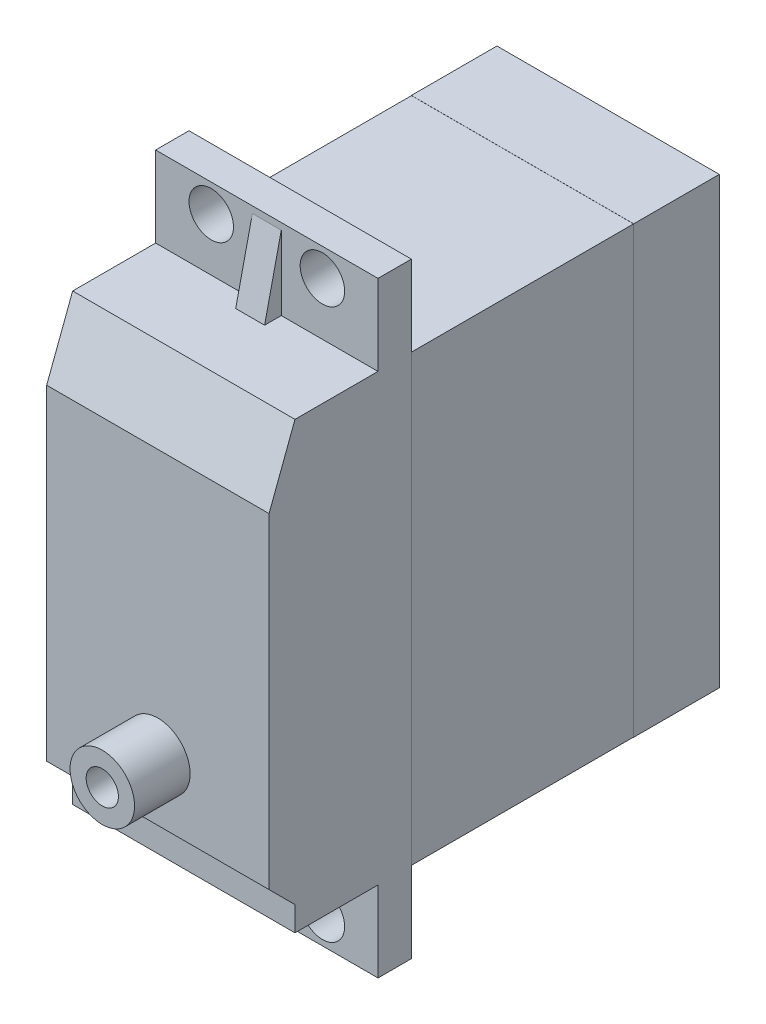
from build123d import *

# Parameters (mm, degrees)
SKETCH1_W                = 40
SKETCH1_H                = 20
BOSS_EXTRUDE1_DEPTH      = 40.5
SKETCH2_W                = 7.25
SKETCH2_H                = 3
BOSS_EXTRUDE2_DEPTH      = 20
SKETCH3_R                = 2
CUT_EXTRUDE1_DEPTH       = 3
SKETCH4_R                = 2.9
SKETCH4_R_2              = 1.45
BOSS_EXTRUDE3_DEPTH      = 5
CUT_EXTRUDE2_DEPTH       = 20
SKETCH5_W                = 20
SKETCH5_H                = 40
SKETCH5_W_2              = 19.98
SKETCH5_H_2              = 39.98
CUT_EXTRUDE3_DEPTH       = 20
BOSS_EXTRUDE5_DEPTH      = 1.3
BOSS_EXTRUDE5_DEPTH_BACK = 1.3


with BuildPart() as part:
    # Sketch1 → Boss-Extrude1 (new body)
    with BuildSketch(Plane(origin=(0, 0, 0), x_dir=(0, 1, 0), z_dir=(0, 0, 1))):
        Rectangle(SKETCH1_W, SKETCH1_H)
    extrude(amount=BOSS_EXTRUDE1_DEPTH)

    # Sketch2 → Boss-Extrude2 (add)
    with BuildSketch(Plane.YZ.offset(10)):
        with Locations((-23.625, 29.2)):
            Rectangle(SKETCH2_W, SKETCH2_H)
        with Locations((23.625, 29.2)):
            Rectangle(SKETCH2_W, SKETCH2_H)
        Polygon((20, 38.166547622), (13.826265312, 40.5), (20, 40.5), align=None)
        Polygon((-20, 38.166547622), (-17.798587441, 38.166547622), (-15.465135063, 40.5), (-20, 40.5), align=None)
    extrude(amount=-BOSS_EXTRUDE2_DEPTH)

    # Sketch3 → Cut-Extrude1 (cut)
    with BuildSketch(Plane.XY.offset(30.7)):
        with Locations((-5, 24.75)):
            Circle(SKETCH3_R)
        with Locations((5, 24.75)):
            Circle(SKETCH3_R)
        with Locations((-5, -24.75)):
            Circle(SKETCH3_R)
        with Locations((5, -24.75)):
            Circle(SKETCH3_R)
    extrude(amount=-CUT_EXTRUDE1_DEPTH, mode=Mode.SUBTRACT)

    # Sketch4 → Boss-Extrude3 (add)
    with BuildSketch(Plane.XY.offset(40.5)):
        with Locations((0, -10)):
            Circle(SKETCH4_R)
        with Locations((0, -10)):
            Circle(SKETCH4_R_2, mode=Mode.SUBTRACT)
    extrude(amount=BOSS_EXTRUDE3_DEPTH)

    # Sketch2<2> → Cut-Extrude2 (cut)
    with BuildSketch(Plane.YZ.offset(10)):
        Polygon((-20, 40.5), (-20, 38.166547622), (-17.798587441, 38.166547622), (-15.465135063, 40.5), align=None)
        Polygon((20, 40.5), (13.826265312, 40.5), (20, 38.166547622), align=None)
    extrude(amount=-CUT_EXTRUDE2_DEPTH, mode=Mode.SUBTRACT)

    # Sketch5 → Cut-Extrude3 (cut)
    with BuildSketch(Plane(origin=(0, 0, 27.7), x_dir=(1, 0, 0), z_dir=(0, 0, -1))):
        Rectangle(SKETCH5_W, SKETCH5_H)
        Rectangle(SKETCH5_W_2, SKETCH5_H_2, mode=Mode.SUBTRACT)
    extrude(amount=CUT_EXTRUDE3_DEPTH, mode=Mode.SUBTRACT)

    # Sketch6 → Boss-Extrude5 (add, two sides: drawn at the far end of the back side and taken through both)
    with BuildSketch(Plane.YZ.offset(-BOSS_EXTRUDE5_DEPTH_BACK)):
        Polygon((-26.65, 30.7), (-20, 32.2), (-20, 30.7), align=None)
        Polygon((20, 32.2), (26.65, 30.7), (20, 30.7), align=None)
    extrude(amount=BOSS_EXTRUDE5_DEPTH + BOSS_EXTRUDE5_DEPTH_BACK)


solid = part.part
